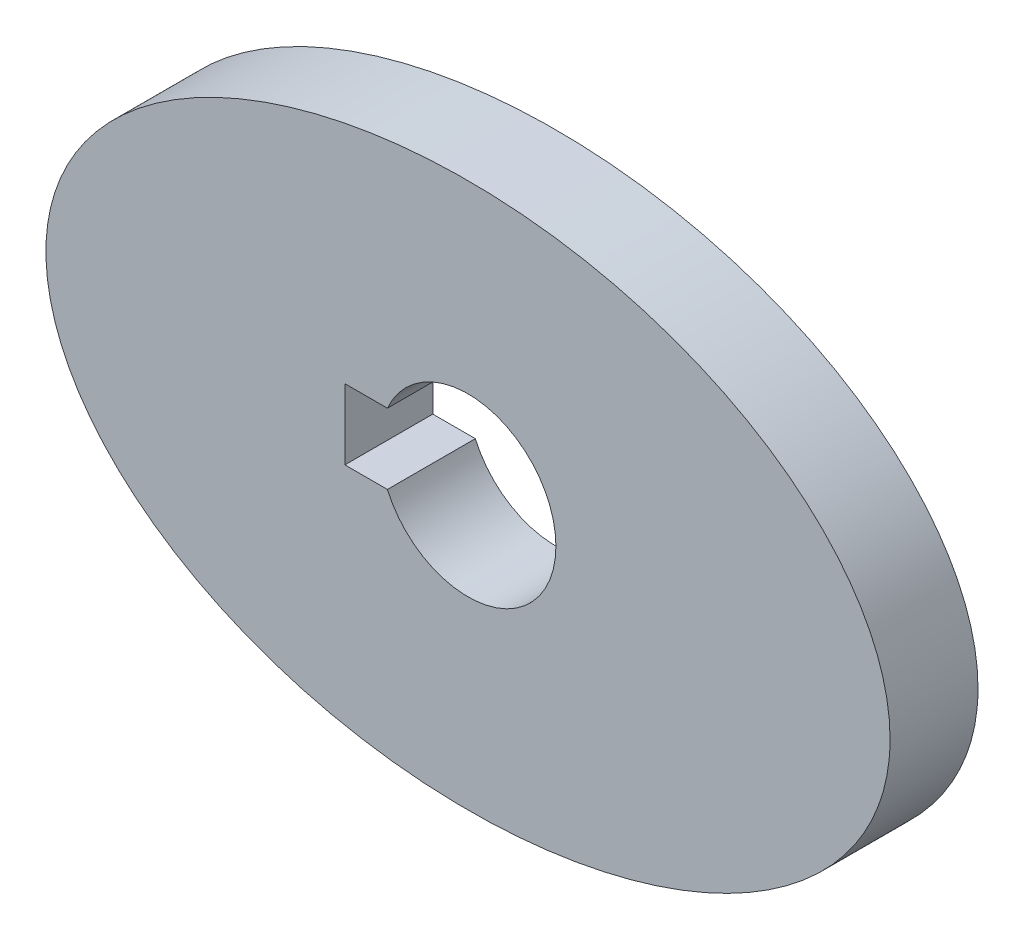
from build123d import *

# Parameters (mm, degrees)
CROQUIS1_RX             = 24
CROQUIS1_RY             = 15.5
SALIENTE_EXTRUIR1_DEPTH = 5


with BuildPart() as part:
    # Croquis1 → Saliente-Extruir1 (new body)
    with BuildSketch(Plane.XY):
        with Locations((0, 0)):
            Ellipse(CROQUIS1_RX, CROQUIS1_RY)
        with BuildLine():
            Line((-7, 2), (-4.582575695, 2))
            ThreePointArc((-4.582575695, 2), (5, 0), (-4.582575695, -2))
            Line((-4.582575695, -2), (-7, -2))
            Line((-7, -2), (-7, 2))
        make_face(mode=Mode.SUBTRACT)
    extrude(amount=SALIENTE_EXTRUIR1_DEPTH)


solid = part.part
